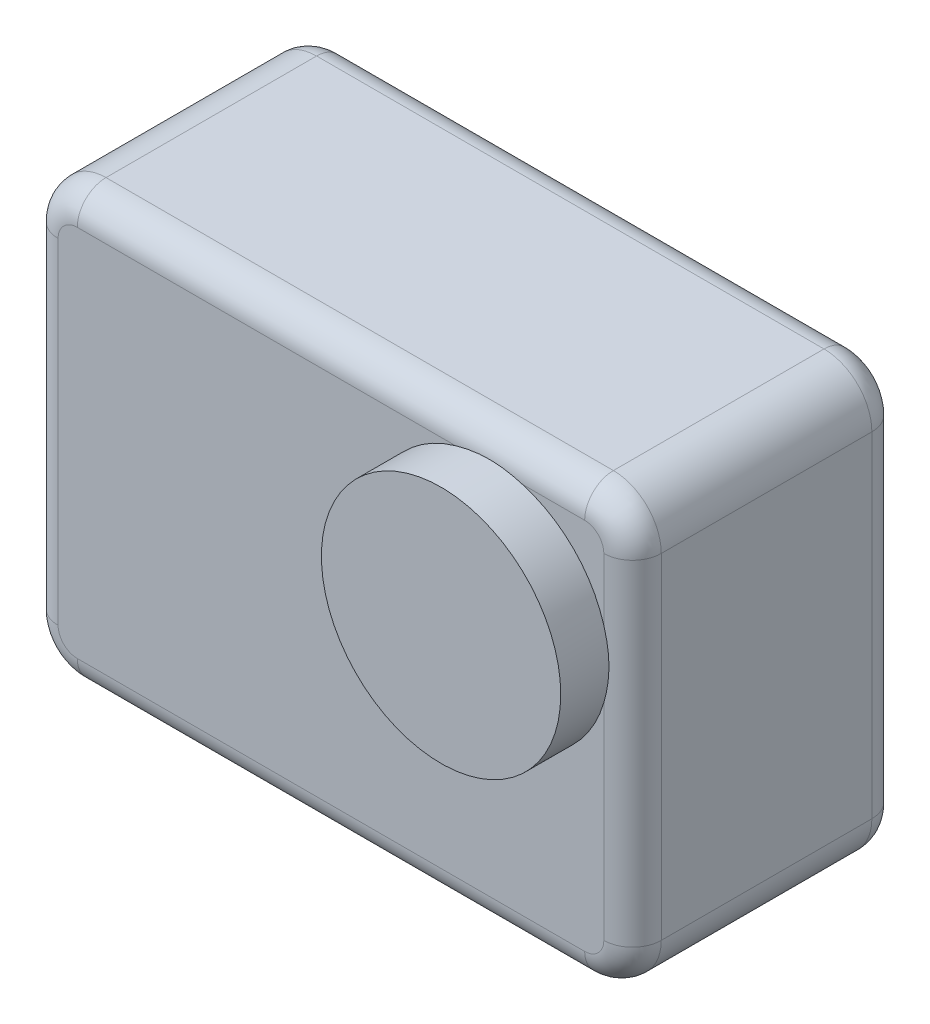
from build123d import *

# Parameters (mm, degrees)
BOSS_EXTRUDE1_DEPTH = 28
FILLET1_R           = 3
SKETCH4_R           = 12.5
BOSS_EXTRUDE3_DEPTH = 5


with BuildPart() as part:
    # Sketch3 → Boss-Extrude1 (new body)
    with BuildSketch(Plane.XY):
        with BuildLine():
            Line((5, 0), (58, 0))
            ThreePointArc((58, 0), (61.535533906, 1.464466094), (63, 5))
            Line((63, 5), (63, 40))
            ThreePointArc((63, 40), (61.535533906, 43.535533906), (58, 45))
            Line((58, 45), (5, 45))
            ThreePointArc((5, 45), (1.464466094, 43.535533906), (0, 40))
            Line((0, 40), (0, 5))
            ThreePointArc((0, 5), (1.464466094, 1.464466094), (5, 0))
        make_face()
    extrude(amount=BOSS_EXTRUDE1_DEPTH)

    # Fillet1
    fillet1_edges = [part.edges().sort_by_distance(p)[0] for p in [
        (63, 22.5, 0),
        (61.535533906, 1.464466094, 0),
        (31.5, 0, 0),
        (1.464466094, 1.464466094, 0),
        (61.535533906, 1.464466094, 28),
        (63, 22.5, 28),
        (61.535533906, 43.535533906, 28),
        (31.5, 45, 28),
        (1.464466094, 43.535533906, 28),
        (0, 22.5, 28),
        (1.464466094, 1.464466094, 28),
        (0, 22.5, 0),
        (31.5, 0, 28),
        (1.464466094, 43.535533906, 0),
        (31.5, 45, 0),
        (61.535533906, 43.535533906, 0),
    ]]
    fillet(fillet1_edges, radius=FILLET1_R)

    # Sketch4 → Boss-Extrude3 (add, symmetric)
    with BuildSketch(Plane.XY.offset(28)):
        with Locations(Location((48, 30, 0), (0, 0, 106.260204708))):
            Circle(SKETCH4_R)
    extrude(amount=BOSS_EXTRUDE3_DEPTH, both=True)


solid = part.part
